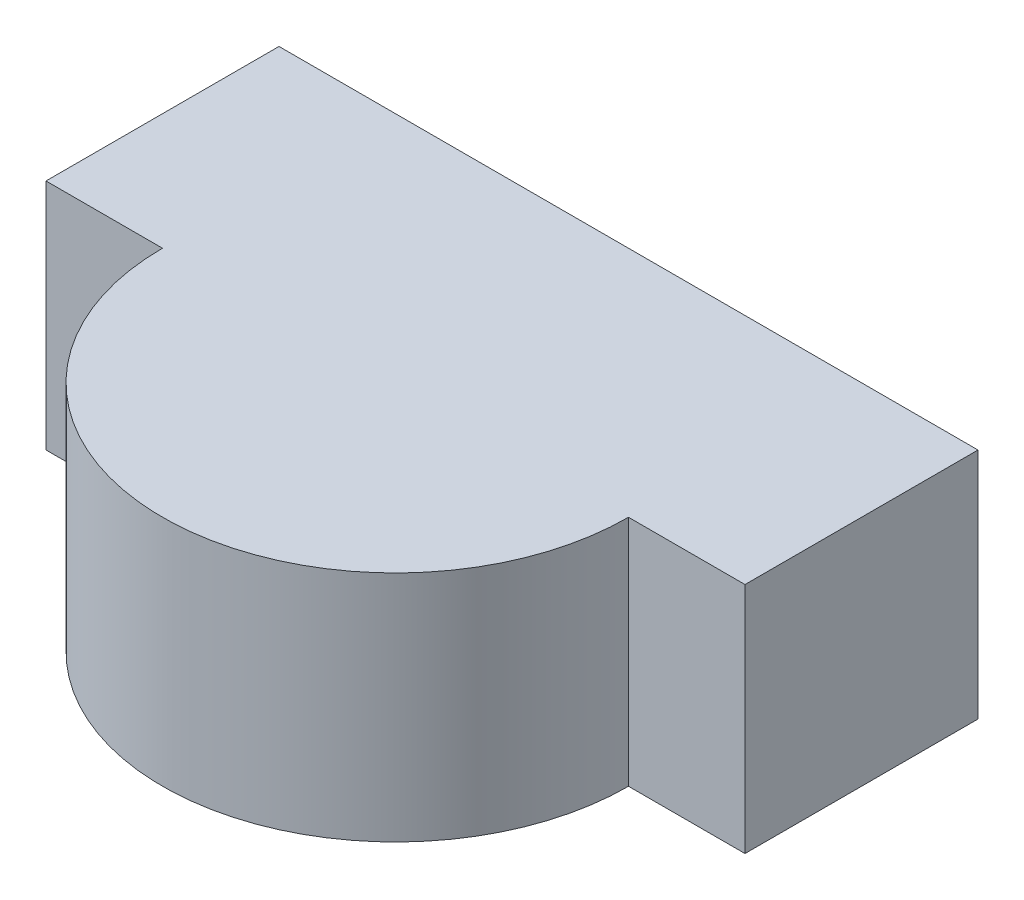
from build123d import *

# Parameters (mm, degrees)
BOSS_EXTRUDE1_DEPTH = 1


with BuildPart() as part:
    # Sketch1 → Boss-Extrude1 (new body)
    with BuildSketch(Plane(origin=(0, 0, 0), x_dir=(1, 0, 0), z_dir=(0, 1, 0))):
        with BuildLine():
            Line((-1.5, 0.5), (1.5, 0.5))
            Line((1.5, 0.5), (1.5, -0.5))
            Line((1.5, -0.5), (1, -0.5))
            ThreePointArc((1, -0.5), (0, -1.5), (-1, -0.5))
            Line((-1, -0.5), (-1.5, -0.5))
            Line((-1.5, -0.5), (-1.5, 0.5))
        make_face()
    extrude(amount=BOSS_EXTRUDE1_DEPTH)


solid = part.part
